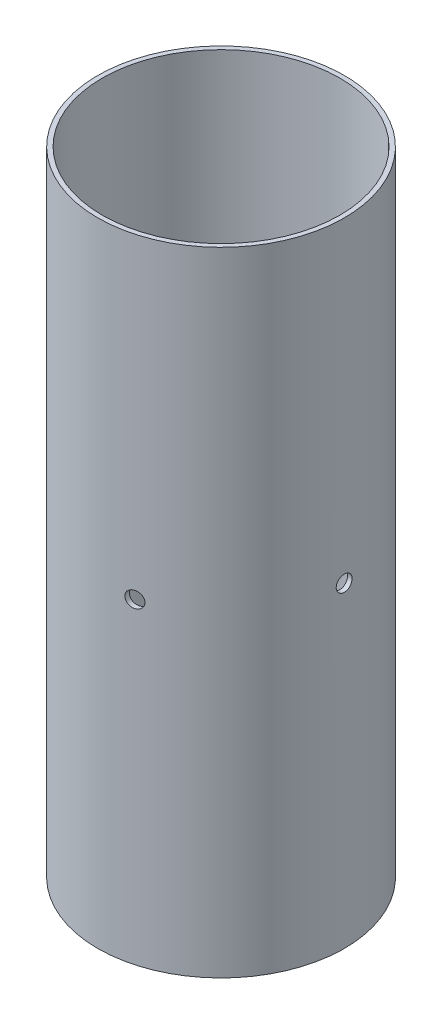
from build123d import *

# Parameters (mm, degrees)
SKETCH1_R               = 49.5046
SKETCH1_R_2             = 47.6885
BOSS_EXTRUDE1_DEPTH     = 254
CUT_EXTRUDE1_DEPTH      = 264.471840701
CUT_EXTRUDE1_DEPTH_BACK = 264.471840701
SKETCH2_R               = 3.175
CUT_EXTRUDE2_DEPTH      = 264.471840835
CUT_EXTRUDE2_DEPTH_BACK = 264.471840835
SKETCH3_R               = 3.175


with BuildPart() as part:
    # Sketch1 → Boss-Extrude1 (new body)
    with BuildSketch(Plane(origin=(0, 0, 0), x_dir=(1, 0, 0), z_dir=(0, 1, 0))):
        with Locations(Location((0, 0, 0), (0, 0, 270))):
            Circle(SKETCH1_R)
        with Locations(Location((0, 0, 0), (0, 0, 270))):
            Circle(SKETCH1_R_2, mode=Mode.SUBTRACT)
    extrude(amount=BOSS_EXTRUDE1_DEPTH)

    # Sketch2 → Cut-Extrude1 (cut, two sides: drawn at the far end of the back side and taken through both)
    with BuildSketch(Plane.XY.offset(-CUT_EXTRUDE1_DEPTH_BACK)):
        with Locations((13.06576, 127)):
            Circle(SKETCH2_R)
    extrude(amount=CUT_EXTRUDE1_DEPTH + CUT_EXTRUDE1_DEPTH_BACK, mode=Mode.SUBTRACT)

    # Sketch3 → Cut-Extrude2 (cut, two sides: drawn at the far end of the back side and taken through both)
    with BuildSketch(Plane(origin=(0, 0, 0), x_dir=(0, 0, -1), z_dir=(1, 0, 0)).offset(-CUT_EXTRUDE2_DEPTH_BACK)):
        with Locations((0, 127)):
            Circle(SKETCH3_R)
    extrude(amount=CUT_EXTRUDE2_DEPTH + CUT_EXTRUDE2_DEPTH_BACK, mode=Mode.SUBTRACT)


solid = part.part
